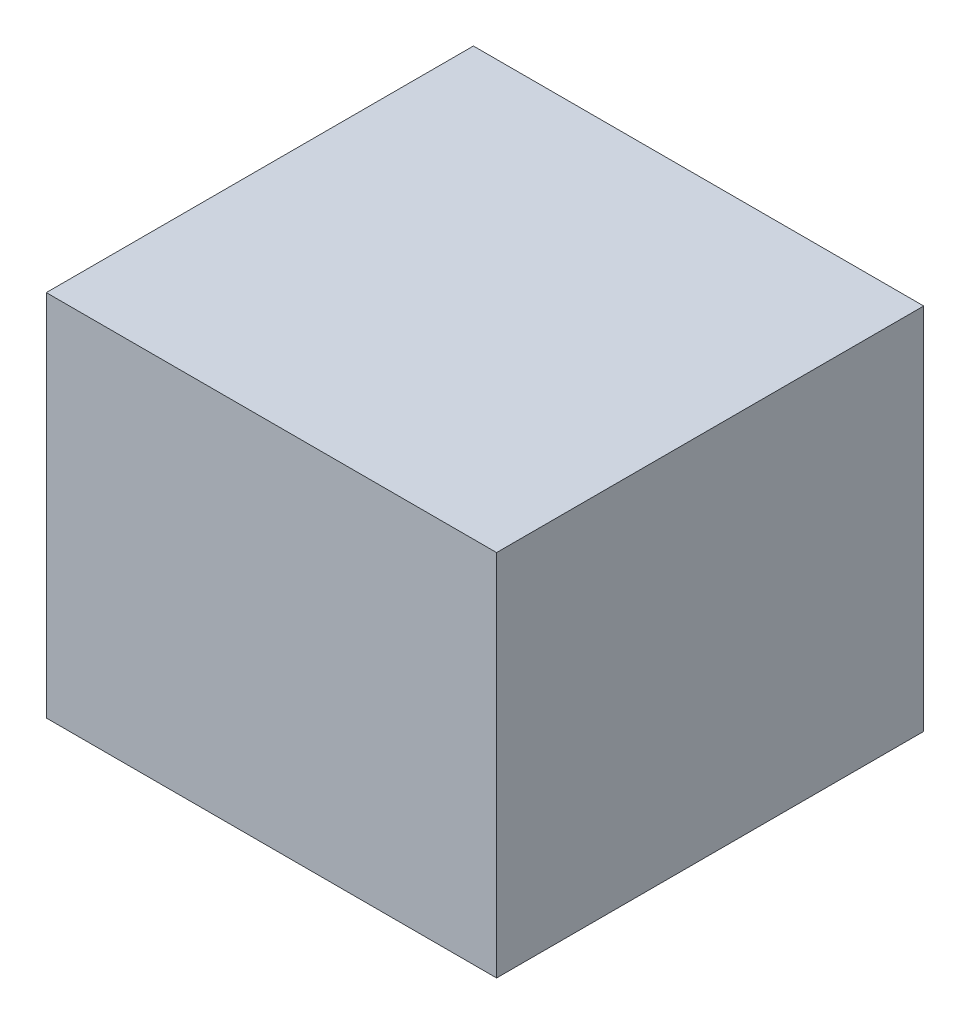
from build123d import *

# Parameters (mm, degrees)
SKETCH1_W           = 16.5
SKETCH1_H           = 13.5
BOSS_EXTRUDE1_DEPTH = 15.65
SKETCH2_W           = 6.4
SKETCH2_H           = 5.096586226
SKETCH2_H_2         = 1.7
SKETCH2_H_3         = 0.9
CUT_EXTRUDE1_DEPTH  = 10


with BuildPart() as part:
    # Sketch1 → Boss-Extrude1 (new body)
    with BuildSketch(Plane.XY):
        Rectangle(SKETCH1_W, SKETCH1_H)
    extrude(amount=BOSS_EXTRUDE1_DEPTH)

    # Sketch2 → Cut-Extrude1 (cut)
    with BuildSketch(Plane.XY):
        Polygon((6.25, -4.85), (6.25, 3.15), (3.2, 3.15), (3.2, -1.946586226), (-3.2, -1.946586226), (-3.2, 3.15), (-6.25, 3.15), (-6.25, -4.85), align=None)
        with Locations((0, 0.601706887)):
            Rectangle(SKETCH2_W, SKETCH2_H)
        with Locations((0, 4)):
            Rectangle(SKETCH2_W, SKETCH2_H_2)
        with Locations((0, 5.3)):
            Rectangle(SKETCH2_W, SKETCH2_H_3)
    extrude(amount=CUT_EXTRUDE1_DEPTH, mode=Mode.SUBTRACT)


solid = part.part
